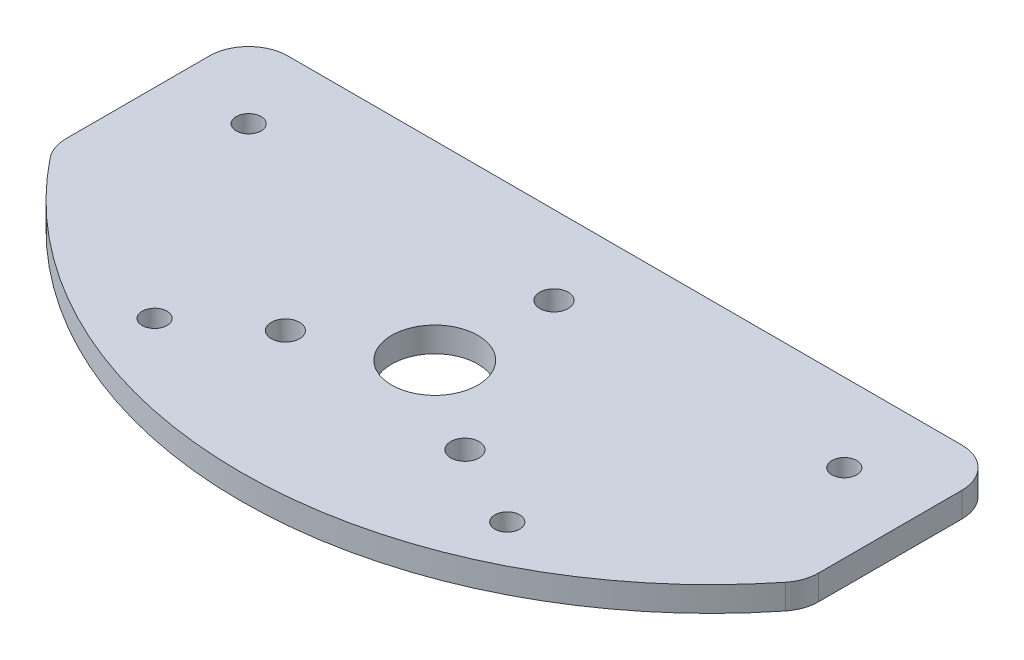
from build123d import *

# Parameters (mm, degrees)
SKETCH5_R           = 38.5
BOSS_EXTRUDE2_DEPTH = 6.36
SKETCH8_R           = 11
CUT_EXTRUDE4_DEPTH  = 55.817420589
BOSS_EXTRUDE3_START = -6.36
SKETCH9_R           = 38.5
BOSS_EXTRUDE3_DEPTH = 6.36
SKETCH10_R          = 3.175
CUT_EXTRUDE5_DEPTH  = 109.197502744
SKETCH12_R          = 3.625
CUT_EXTRUDE6_DEPTH  = 109.197502744
FILLET1_R           = 10


with BuildPart() as part:
    # Sketch5 → Boss-Extrude2 (new body)
    with BuildSketch(Plane(origin=(0, 0, 0), x_dir=(1, 0, 0), z_dir=(0, 1, 0))):
        with Locations(Location((0, 0, 0), (0, 0, 90))):
            Circle(SKETCH5_R)
    extrude(amount=BOSS_EXTRUDE2_DEPTH)

    # Sketch8 → Cut-Extrude4 (cut, through all)
    with BuildSketch(Plane(origin=(0, 6.36, 0), x_dir=(1, 0, 0), z_dir=(0, 1, 0))):
        with Locations(Location((0, 0, 0), (0, 0, 270))):
            Circle(SKETCH8_R)
    extrude(amount=-CUT_EXTRUDE4_DEPTH, mode=Mode.SUBTRACT)

    # Sketch9 → Boss-Extrude3 (add)
    with BuildSketch(Plane(origin=(0, 6.36, 0), x_dir=(1, 0, 0), z_dir=(0, 1, 0)).offset(BOSS_EXTRUDE3_START)):
        with BuildLine():
            Line((-96, 48.5), (96, 48.5))
            Line((96, 48.5), (96, -1.5))
            ThreePointArc((96, -1.5), (0, -49.5), (-96, -1.5))
            Line((-96, -1.5), (-96, 48.5))
        make_face()
        Circle(SKETCH9_R, mode=Mode.SUBTRACT)
    extrude(amount=BOSS_EXTRUDE3_DEPTH)

    # Sketch10 → Cut-Extrude5 (cut, through all)
    with BuildSketch(Plane(origin=(0, 6.36, 0), x_dir=(1, 0, 0), z_dir=(0, 1, 0))):
        with Locations(Location((-76, 28.5, 0), (0, 0, 270))):
            Circle(SKETCH10_R)
        with Locations(Location((-45, -26.5, 0), (0, 0, 270))):
            Circle(SKETCH10_R)
        with Locations(Location((45, -26.5, 0), (0, 0, 90))):
            Circle(SKETCH10_R)
        with Locations(Location((76, 28.5, 0), (0, 0, 90))):
            Circle(SKETCH10_R)
    extrude(amount=-CUT_EXTRUDE5_DEPTH, mode=Mode.SUBTRACT)

    # Sketch12 → Cut-Extrude6 (cut, through all)
    with BuildSketch(Plane(origin=(0, 6.36, 0), x_dir=(1, 0, 0), z_dir=(0, 1, 0))):
        with Locations(Location((1.988059502, 28.430575432, 0), (0, 0, 270))):
            Circle(SKETCH12_R)
        with Locations(Location((23.627570818, -15.936997749, 0), (0, 0, 270))):
            Circle(SKETCH12_R)
        with Locations(Location((-25.61563032, -12.493577683, 0), (0, 0, 270))):
            Circle(SKETCH12_R)
    extrude(amount=-CUT_EXTRUDE6_DEPTH, mode=Mode.SUBTRACT)

    # Fillet1
    fillet1_edges = [part.edges().sort_by_distance(p)[0] for p in [
        (96, 3.18, 1.5),
        (96, 3.18, -48.5),
        (-96, 3.18, -48.5),
        (-96, 3.18, 1.5),
    ]]
    fillet(fillet1_edges, radius=FILLET1_R)


solid = part.part
